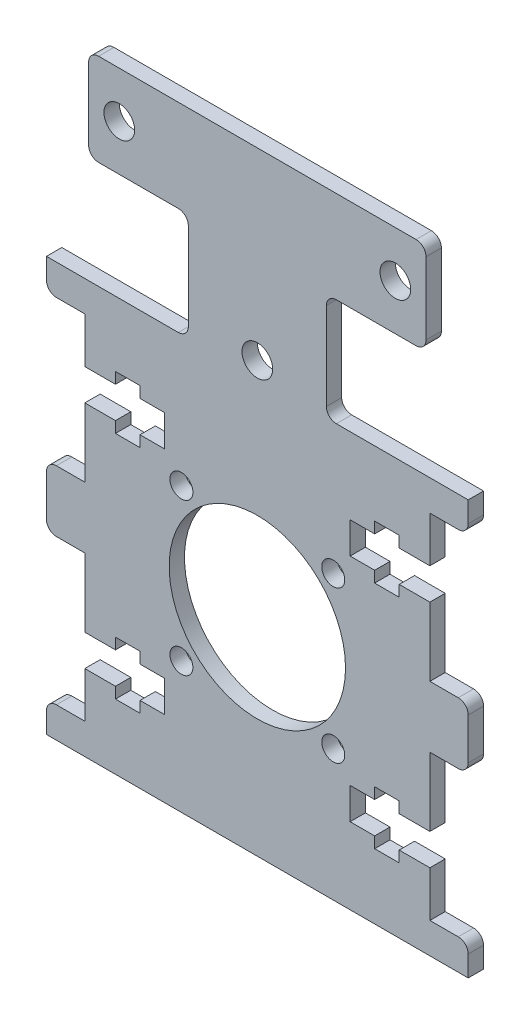
from build123d import *

# Parameters (mm, degrees)
SKETCH_1_R      = 1.5
SKETCH_1_R_2    = 11.5
SKETCH_1_R_3    = 2
EXTRUDE_1_DEPTH = 2
FILLET_1_R      = 1.3


with BuildPart() as part:
    # 草图1 → 凸台-拉伸1 (new body)
    with BuildSketch(Plane.XY):
        Polygon((22.5, -27), (-22.5, -27), (-27.5, -27), (-27.5, -23), (-22.5, -23), (-22.5, -17.05), (-18.5, -17.05), (-18.5, -18.5), (-15.3, -18.5), (-15.3, -17.05), (-12.1, -17.05), (-12.1, -12.95), (-15.3, -12.95), (-15.3, -11.5), (-18.5, -11.5), (-18.5, -12.95), (-22.5, -12.95), (-22.5, -4), (-27.5, -4), (-27.5, 4), (-22.5, 4), (-22.5, 12.95), (-18.5, 12.95), (-18.5, 11.5), (-15.3, 11.5), (-15.3, 12.95), (-12.1, 12.95), (-12.1, 17.05), (-15.3, 17.05), (-15.3, 18.5), (-18.5, 18.5), (-18.5, 17.05), (-22.5, 17.05), (-22.5, 23), (-27.5, 23), (-27.5, 27), (-22.5, 27), (-9, 27), (-9, 41), (-22, 41), (-22, 53), (22, 53), (22, 41), (9, 41), (9, 27), (22.5, 27), (27.5, 27), (27.5, 23), (22.5, 23), (22.5, 17.05), (18.5, 17.05), (18.5, 18.5), (15.3, 18.5), (15.3, 17.05), (12.1, 17.05), (12.1, 12.95), (15.3, 12.95), (15.3, 11.5), (18.5, 11.5), (18.5, 12.95), (22.5, 12.95), (22.5, 4), (27.5, 4), (27.5, -4), (22.5, -4), (22.5, -12.95), (18.5, -12.95), (18.5, -11.5), (15.3, -11.5), (15.3, -12.95), (12.1, -12.95), (12.1, -17.05), (15.3, -17.05), (15.3, -18.5), (18.5, -18.5), (18.5, -17.05), (22.5, -17.05), (22.5, -23), (27.5, -23), (27.5, -27), align=None)
        with Locations((9.899494937, 9.899494937)):
            Circle(SKETCH_1_R, mode=Mode.SUBTRACT)
        Circle(SKETCH_1_R_2, mode=Mode.SUBTRACT)
        with Locations((9.899494937, -9.899494937)):
            Circle(SKETCH_1_R, mode=Mode.SUBTRACT)
        with Locations((-9.899494937, -9.899494937)):
            Circle(SKETCH_1_R, mode=Mode.SUBTRACT)
        with Locations((-9.899494937, 9.899494937)):
            Circle(SKETCH_1_R, mode=Mode.SUBTRACT)
        with Locations((-18, 47)):
            Circle(SKETCH_1_R_3, mode=Mode.SUBTRACT)
        with Locations((18, 47)):
            Circle(SKETCH_1_R_3, mode=Mode.SUBTRACT)
        with Locations((0, 29)):
            Circle(SKETCH_1_R_3, mode=Mode.SUBTRACT)
    extrude(amount=EXTRUDE_1_DEPTH)

    # 圆角1
    fillet_1_edges = [part.edges().sort_by_distance(p)[0] for p in [
        (-9, 27, 1),
        (-9, 41, 1),
        (-22, 41, 1),
        (-22, 53, 1),
        (22, 53, 1),
        (22, 41, 1),
        (9, 41, 1),
        (9, 27, 1),
        (27.5, 23, 1),
        (27.5, 4, 1),
        (27.5, -4, 1),
        (27.5, -23, 1),
        (-27.5, -23, 1),
        (-27.5, -4, 1),
        (-27.5, 4, 1),
        (-27.5, 23, 1),
    ]]
    fillet(fillet_1_edges, radius=FILLET_1_R)


solid = part.part
